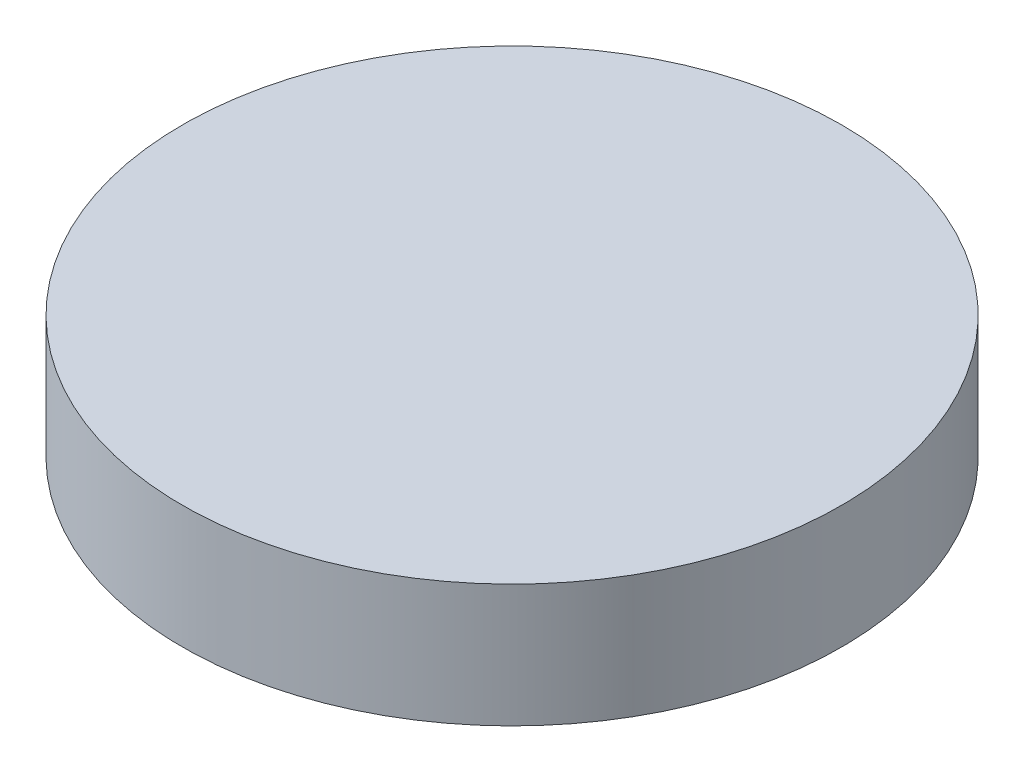
from build123d import *

# Parameters (mm, degrees)
SKETCH1_R           = 51.1302
BOSS_EXTRUDE1_DEPTH = 19.05


with BuildPart() as part:
    # Sketch1 → Boss-Extrude1 (new body)
    with BuildSketch(Plane(origin=(0, 0, 0), x_dir=(1, 0, 0), z_dir=(0, 1, 0))):
        with Locations(Location((0, 0, 0), (0, 0, 90))):
            Circle(SKETCH1_R)
    extrude(amount=BOSS_EXTRUDE1_DEPTH)


solid = part.part
